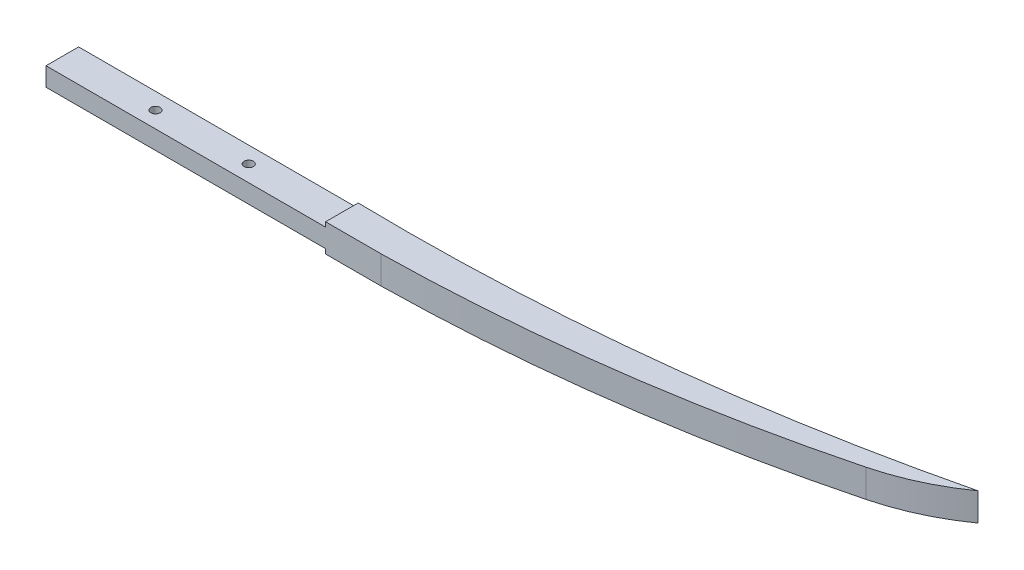
from build123d import *

# Parameters (mm, degrees)
BOSS_EXTRUDE1_DEPTH    = 30
SKETCH2_W              = 35
SKETCH2_H              = 20
BOSS_EXTRUDE2_DEPTH    = 300
F_10_0MM_DOWEL_HOLE1_D = 10


with BuildPart() as part:
    # Sketch1 → Boss-Extrude1 (new body)
    with BuildSketch(Plane(origin=(0, 0, 0), x_dir=(1, 0, 0), z_dir=(0, 1, 0))):
        with BuildLine():
            Line((0, 35), (0, 0))
            Line((0, 0), (59.446550687, 0))
            ThreePointArc((59.446550687, 0), (290.555085126, 17.296607549), (517.979369235, 61.889458105))
            ThreePointArc((517.979369235, 61.889458105), (560.727418369, 77.204818483), (600, 100))
            ThreePointArc((600, 100), (302.095278427, 48.158968364), (0, 35))
        make_face()
    extrude(amount=BOSS_EXTRUDE1_DEPTH)

    # Sketch2 → Boss-Extrude2 (add)
    with BuildSketch(Plane.ZY):
        with Locations((-17.5, 15)):
            Rectangle(SKETCH2_W, SKETCH2_H)
    extrude(amount=BOSS_EXTRUDE2_DEPTH)

    # Ø10.0mm Dowel Hole1 (through all)
    with Locations(Plane(origin=(0, 25, 0), x_dir=(1, 0, 0), z_dir=(0, 1, 0))):
        with Locations((-200, 17.5), (-100, 17.5)):
            Hole(F_10_0MM_DOWEL_HOLE1_D / 2)


solid = part.part
